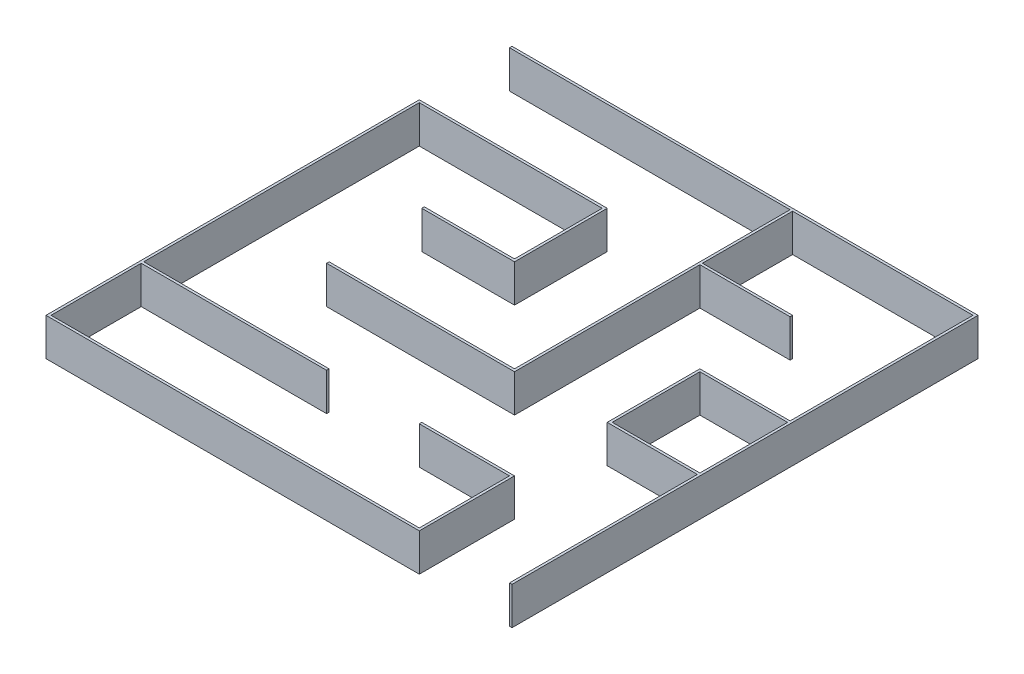
from build123d import *

# Parameters (mm, degrees)
BOSS_EXTRUDE3_DEPTH   = 150
SKETCH2_W             = 350
SKETCH2_H             = 350
BOSS_EXTRUDE3_2_DEPTH = 150


with BuildPart() as part:
    # Sketch2 → Boss-Extrude3 (new body)
    with BuildSketch(Plane(origin=(0, 0, 0), x_dir=(1, 0, 0), z_dir=(0, 1, 0))):
        Polygon((150, 757.491220574), (150, 397.491220574), (1620, 397.491220574), (1620, 757.491220574), (1260, 757.491220574), (1260, 767.491220574), (1630, 767.491220574), (1630, 387.491220574), (140, 387.491220574), (140, 1877.491220574), (890, 1877.491220574), (890, 1507.491220574), (520, 1507.491220574), (520, 1517.491220574), (880, 1517.491220574), (880, 1867.491220574), (150, 1867.491220574), (150, 767.491220574), (890, 767.491220574), (890, 757.491220574), align=None)
    extrude(amount=BOSS_EXTRUDE3_DEPTH)


with BuildPart() as body_2:
    # Sketch2 → Boss-Extrude3 2 (new body)
    with BuildSketch(Plane(origin=(0, 0, 0), x_dir=(1, 0, 0), z_dir=(0, 1, 0))):
        Polygon((2000, 387.491220574), (2000, 2247.491220574), (140, 2247.491220574), (140, 2237.491220574), (1260, 2237.491220574), (1260, 1137.491220574), (520, 1137.491220574), (520, 1127.491220574), (1270, 1127.491220574), (1270, 1867.491220574), (1630, 1867.491220574), (1630, 1877.491220574), (1270, 1877.491220574), (1270, 2237.491220574), (1990, 2237.491220574), (1990, 1507.491220574), (1630, 1507.491220574), (1630, 1137.491220574), (1990, 1137.491220574), (1990, 387.491220574), align=None)
        with Locations((1815, 1322.491220574)):
            Rectangle(SKETCH2_W, SKETCH2_H, mode=Mode.SUBTRACT)
    extrude(amount=BOSS_EXTRUDE3_2_DEPTH)


solid = Compound([part.part, body_2.part])
